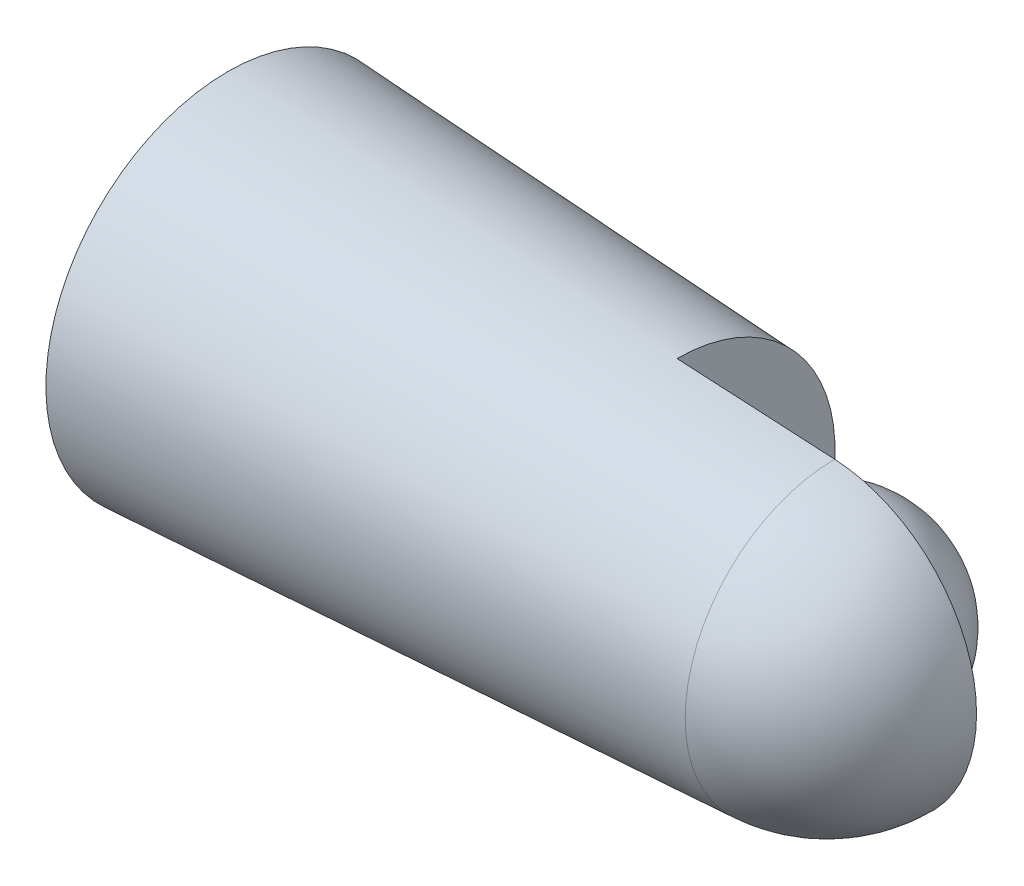
from build123d import *

# Parameters (mm, degrees)
SKETCH2_R          = 35
CUT_EXTRUDE1_DEPTH = 20
SKETCH3_W          = 70
SKETCH3_H          = 100
CUT_EXTRUDE2_DEPTH = 53


with BuildPart() as part:
    # Sketch1 → Revolve1 (revolve)
    with BuildSketch(Plane(origin=(0, 0, 0), x_dir=(1, 0, 0), z_dir=(0, 1, 0)), mode=Mode.PRIVATE) as revolve1_sk:
        with BuildLine():
            Line((35, 0), (-140, 0))
            Line((-140, 0), (-140, 42.5))
            Line((-140, 42.5), (1.859986247, 34.950542931))
            ThreePointArc((1.859986247, 34.950542931), (25.397829815, 24.082156064), (35, 0))
        make_face()
    revolve(revolve1_sk.sketch.rotate(Axis((35, 0, 0), (-1, 0, 0)), 180), axis=Axis((35, 0, 0), (-1, 0, 0)))

    # Sketch2 → Cut-Extrude1 (cut)
    with BuildSketch(Plane.ZY.offset(140)):
        Circle(SKETCH2_R)
    extrude(amount=-CUT_EXTRUDE1_DEPTH, mode=Mode.SUBTRACT)

    # Sketch3 → Cut-Extrude2 (cut)
    with BuildSketch(Plane.XY):
        Rectangle(SKETCH3_W, SKETCH3_H)
    extrude(amount=-CUT_EXTRUDE2_DEPTH, mode=Mode.SUBTRACT)

    # Sketch4 → Revolve2 (revolve)
    with BuildSketch(Plane.XY):
        with BuildLine():
            Line((25, 0), (-25, 0))
            ThreePointArc((-25, 0), (0, 25), (25, 0))
        make_face()
    revolve(axis=Axis((25, 0, 0), (-1, 0, 0)))


solid = part.part
